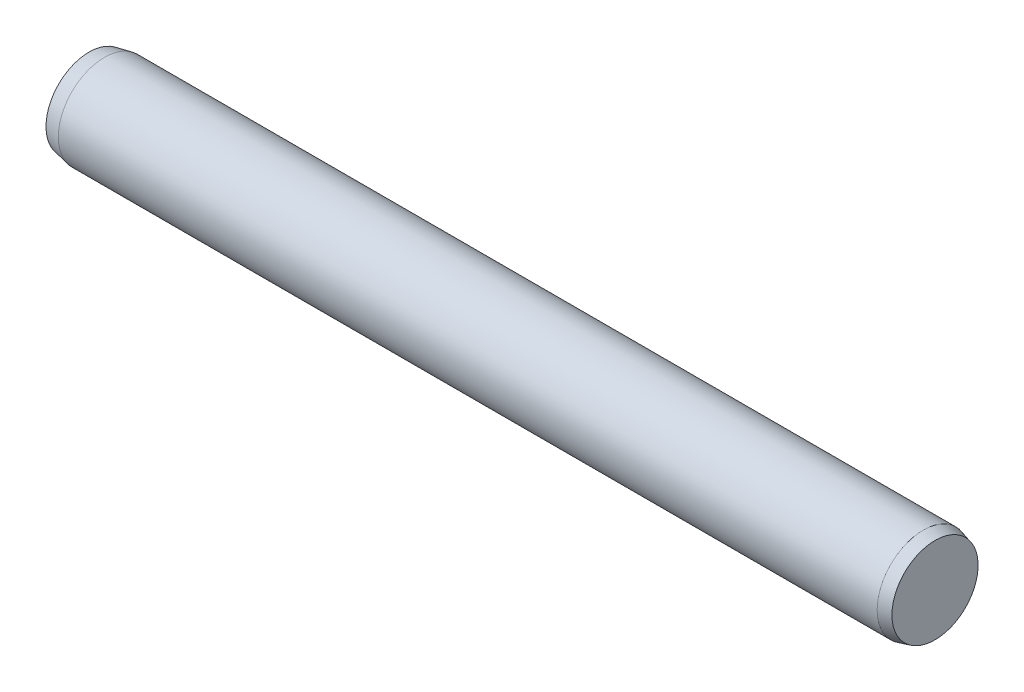
from build123d import *


with BuildPart() as part:
    # Sketch1 → Revolve1 (revolve)
    with BuildSketch(Plane(origin=(0, 0, 0), x_dir=(-1, 0, 0), z_dir=(0, 0, -1)), mode=Mode.PRIVATE) as revolve1_sk:
        Polygon((-76.2, 3.2004), (-76.2, 0.4004), (-21.2, 0.4004), (-21.2, 3.2004), (-22.2, 3.4004), (-75.438, 3.4004), align=None)
    revolve(revolve1_sk.sketch.rotate(Axis((76.2, 0.4004, 0), (-1, 0, 0)), 270), axis=Axis((76.2, 0.4004, 0), (-1, 0, 0)))


solid = part.part
